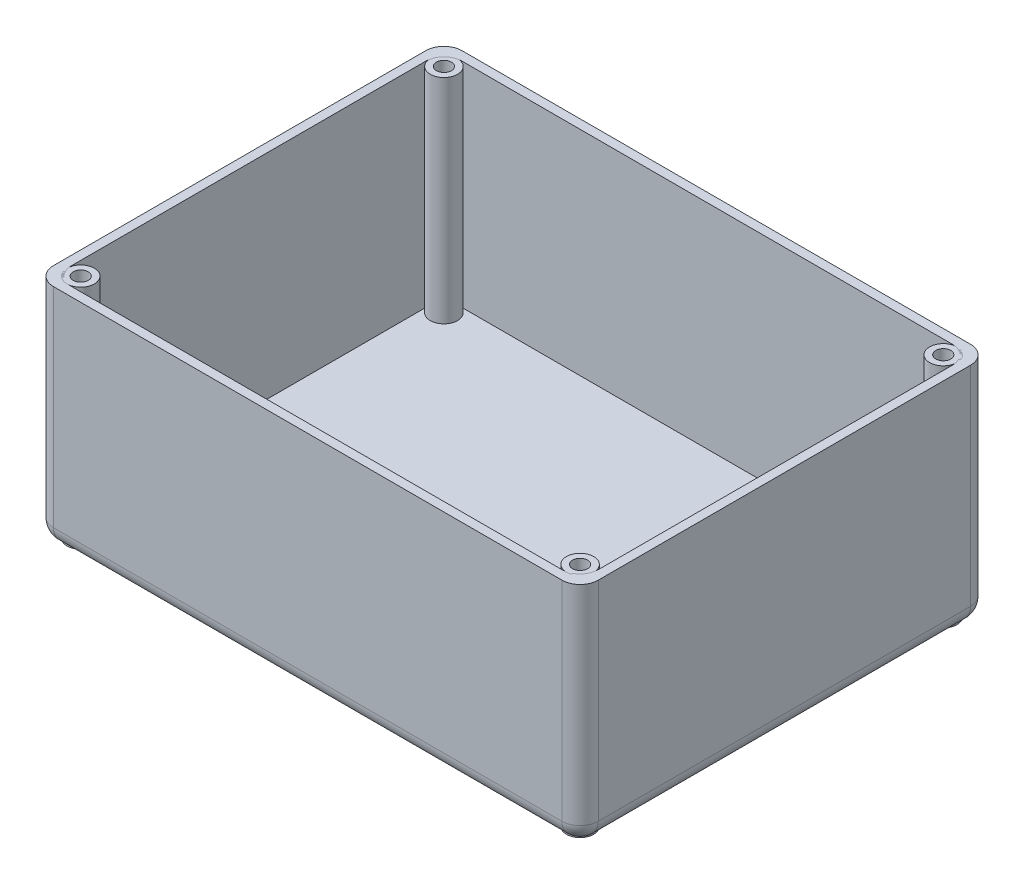
from build123d import *

# Parameters (mm, degrees)
SKETCH1_W             = 120
SKETCH1_H             = 90
BOSS_EXTRUDE1_DEPTH   = 50
SKETCH2_W             = 116
SKETCH2_H             = 86
CUT_EXTRUDE1_DEPTH    = 47
SKETCH5_R             = 3
SKETCH5_R_2           = 1.65
BOSS_EXTRUDE5_DEPTH   = 50
BOSS_EXTRUDE5_2_DEPTH = 50
BOSS_EXTRUDE5_3_DEPTH = 50
BOSS_EXTRUDE5_4_DEPTH = 50
FILLET1_R             = 4
FILLET2_R             = 4
FILLET3_R             = 4


with BuildPart() as part:
    # Sketch1 → Boss-Extrude1 (new body)
    with BuildSketch(Plane(origin=(0, 0, 0), x_dir=(1, 0, 0), z_dir=(0, 1, 0))):
        with Locations((-15.078534031, -11.544502618)):
            Rectangle(SKETCH1_W, SKETCH1_H)
    extrude(amount=BOSS_EXTRUDE1_DEPTH)

    # Sketch2 → Cut-Extrude1 (cut)
    with BuildSketch(Plane(origin=(0, 50, 0), x_dir=(1, 0, 0), z_dir=(0, 1, 0))):
        with Locations((-15.078534031, -11.544502618)):
            Rectangle(SKETCH2_W, SKETCH2_H)
    extrude(amount=-CUT_EXTRUDE1_DEPTH, mode=Mode.SUBTRACT)

    # Fillet1
    fillet1_edges = [part.edges().sort_by_distance(p)[0] for p in [
        (-75.078534031, 25, -33.455497382),
        (44.921465969, 25, -33.455497382),
        (44.921465969, 25, 56.544502618),
        (-75.078534031, 25, 56.544502618),
    ]]
    fillet(fillet1_edges, radius=FILLET1_R)

    # Fillet2
    fillet2_edges = [part.edges().sort_by_distance(p)[0] for p in [
        (-15.078534031, 0, -33.455497382),
        (-75.078534031, 0, 11.544502618),
        (44.921465969, 0, 11.544502618),
        (-15.078534031, 0, 56.544502618),
        (-73.906961156, 0, -32.283924507),
        (-73.906961156, 0, 55.372929743),
        (43.749893093, 0, 55.372929743),
        (43.749893093, 0, -32.283924507),
    ]]
    fillet(fillet2_edges, radius=FILLET2_R)

    # Fillet3
    fillet3_edges = [part.edges().sort_by_distance(p)[0] for p in [
        (-73.078534031, 26.5, 54.544502618),
        (-73.078534031, 26.5, -31.455497382),
        (42.921465969, 26.5, -31.455497382),
        (42.921465969, 26.5, 54.544502618),
    ]]
    fillet(fillet3_edges, radius=FILLET3_R)


with BuildPart() as body_2:
    # Sketch5 → Boss-Extrude5 (new body)
    with BuildSketch(Plane.XZ):
        with Locations(Location((39.921465969, 51.544502618, 0), (0, 0, 270))):
            Circle(SKETCH5_R)
        with Locations(Location((39.921465969, 51.544502618, 0), (0, 0, 270))):
            Circle(SKETCH5_R_2, mode=Mode.SUBTRACT)
    extrude(amount=-BOSS_EXTRUDE5_DEPTH)


with BuildPart() as body_3:
    # Sketch5 → Boss-Extrude5 2 (new body)
    with BuildSketch(Plane.XZ):
        with Locations(Location((-70.078534031, -28.455497382, 0), (0, 0, 270))):
            Circle(SKETCH5_R)
        with Locations(Location((-70.078534031, -28.455497382, 0), (0, 0, 270))):
            Circle(SKETCH5_R_2, mode=Mode.SUBTRACT)
    extrude(amount=-BOSS_EXTRUDE5_2_DEPTH)


with BuildPart() as body_4:
    # Sketch5 → Boss-Extrude5 3 (new body)
    with BuildSketch(Plane.XZ):
        with Locations(Location((-70.078534031, 51.544502618, 0), (0, 0, 270))):
            Circle(SKETCH5_R)
        with Locations(Location((-70.078534031, 51.544502618, 0), (0, 0, 270))):
            Circle(SKETCH5_R_2, mode=Mode.SUBTRACT)
    extrude(amount=-BOSS_EXTRUDE5_3_DEPTH)


with BuildPart() as body_5:
    # Sketch5 → Boss-Extrude5 4 (new body)
    with BuildSketch(Plane.XZ):
        with Locations(Location((39.921465969, -28.455497382, 0), (0, 0, 270))):
            Circle(SKETCH5_R)
        with Locations(Location((39.921465969, -28.455497382, 0), (0, 0, 270))):
            Circle(SKETCH5_R_2, mode=Mode.SUBTRACT)
    extrude(amount=-BOSS_EXTRUDE5_4_DEPTH)


solid = Compound([part.part, body_2.part, body_3.part, body_4.part, body_5.part])
